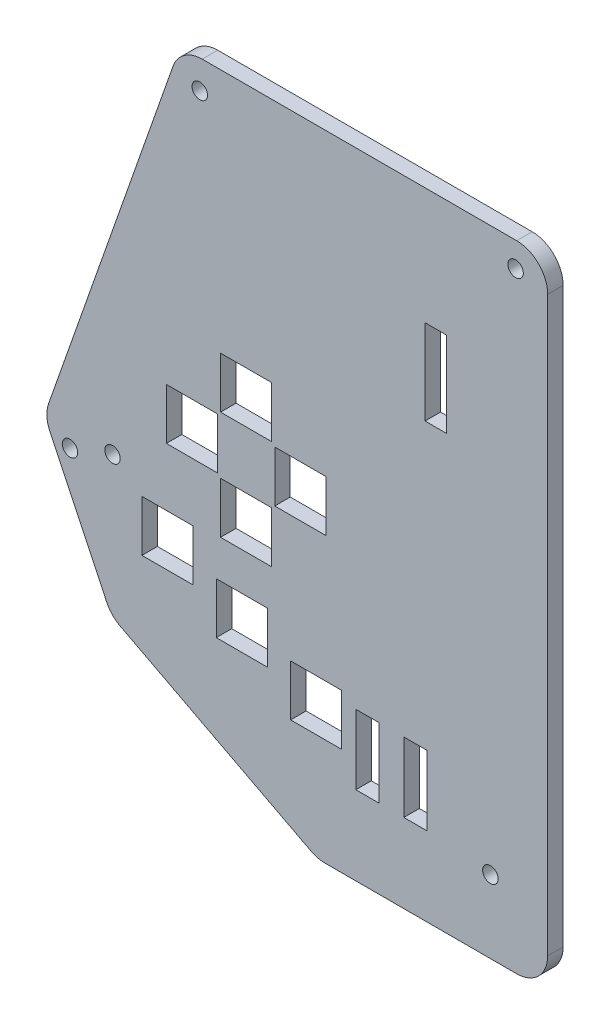
from build123d import *

# Parameters (mm, degrees)
BOSS_EXTRUDE1_DEPTH     = 2.54
CUT_EXTRUDE1_DEPTH      = 112.420336115
CUT_EXTRUDE1_DEPTH_BACK = 112.420336115
SKETCH11_W              = 3.81
SKETCH11_H              = 11.43
SKETCH11_W_2            = 8.382
SKETCH11_H_2            = 8.382
CUT_EXTRUDE2_DEPTH      = 112.420336115
CUT_EXTRUDE2_DEPTH_BACK = 112.420336115
SKETCH12_R              = 1.27
CUT_EXTRUDE3_DEPTH      = 112.420336115
CUT_EXTRUDE3_DEPTH_BACK = 112.420336115
SKETCH13_R              = 1.27
CUT_EXTRUDE4_DEPTH      = 112.420336115
CUT_EXTRUDE4_DEPTH_BACK = 112.420336115
SKETCH14_W              = 3.556
SKETCH14_H              = 13.97


with BuildPart() as part:
    # Sketch10 → Boss-Extrude1 (new body)
    with BuildSketch(Plane.XY):
        with BuildLine():
            Line((53.34, 1.27), (53.34, -92.71))
            ThreePointArc((53.34, -92.71), (51.852102448, -96.302102448), (48.26, -97.79))
            Line((48.26, -97.79), (16.846989059, -97.79))
            ThreePointArc((16.846989059, -97.79), (15.638688158, -97.644208035), (14.499741809, -97.215200367))
            Line((14.499741809, -97.215200367), (-16.7505185, -80.933552139))
            ThreePointArc((-16.7505185, -80.933552139), (-18.059258376, -79.955412607), (-18.989802686, -78.61241436))
            Line((-18.989802686, -78.61241436), (-28.309569459, -59.040904135))
            ThreePointArc((-28.309569459, -59.040904135), (-28.795802898, -57.127870198), (-28.51617555, -55.173917704))
            Line((-28.51617555, -55.173917704), (-8.107195629, 2.952923842))
            ThreePointArc((-8.107195629, 2.952923842), (-6.251501454, 5.414614163), (-3.314058103, 6.35))
            Line((-3.314058103, 6.35), (48.26, 6.35))
            ThreePointArc((48.26, 6.35), (51.852102448, 4.862102448), (53.34, 1.27))
        make_face()
    extrude(amount=BOSS_EXTRUDE1_DEPTH)

    # Sketch11 → Cut-Extrude1 (cut, two sides: drawn at the far end of the back side and taken through both)
    with BuildSketch(Plane.XY.offset(2.54).offset(-CUT_EXTRUDE1_DEPTH_BACK)):
        with Locations((31.65602, -79.121)):
            Rectangle(SKETCH11_W, SKETCH11_H)
        with Locations((23.78202, -79.121)):
            Rectangle(SKETCH11_W, SKETCH11_H)
        with Locations((3.878385852, -55.88)):
            Rectangle(SKETCH11_W_2, SKETCH11_H_2)
        with Locations((-5.011614148, -46.99)):
            Rectangle(SKETCH11_W_2, SKETCH11_H_2)
        with Locations((3.878385852, -38.1)):
            Rectangle(SKETCH11_W_2, SKETCH11_H_2)
        with Locations((12.768385852, -46.99)):
            Rectangle(SKETCH11_W_2, SKETCH11_H_2)
        with Locations((-9.017, -64.897)):
            Rectangle(SKETCH11_W_2, SKETCH11_H_2)
        with Locations((3.175, -70.485)):
            Rectangle(SKETCH11_W_2, SKETCH11_H_2)
        with Locations((15.367, -76.073)):
            Rectangle(SKETCH11_W_2, SKETCH11_H_2)
    extrude(amount=CUT_EXTRUDE1_DEPTH + CUT_EXTRUDE1_DEPTH_BACK, mode=Mode.SUBTRACT)

    # Sketch12 → Cut-Extrude2 (cut, two sides: drawn at the far end of the back side and taken through both)
    with BuildSketch(Plane(origin=(0, 0, 0), x_dir=(-1, 0, 0), z_dir=(0, 0, -1)).offset(-CUT_EXTRUDE2_DEPTH_BACK)):
        with Locations((18.034, -57.15)):
            Circle(SKETCH12_R)
        with Locations((-43.942, -85.852)):
            Circle(SKETCH12_R)
    extrude(amount=CUT_EXTRUDE2_DEPTH + CUT_EXTRUDE2_DEPTH_BACK, mode=Mode.SUBTRACT)

    # Sketch13 → Cut-Extrude3 (cut, two sides: drawn at the far end of the back side and taken through both)
    with BuildSketch(Plane(origin=(0, 0, 0), x_dir=(-1, 0, 0), z_dir=(0, 0, -1)).offset(-CUT_EXTRUDE3_DEPTH_BACK)):
        with Locations((25.012261453, -59.761967182)):
            Circle(SKETCH13_R)
        with Locations((-48.0822, 2.286)):
            Circle(SKETCH13_R)
        with Locations((3.718687848, 1.651)):
            Circle(SKETCH13_R)
    extrude(amount=CUT_EXTRUDE3_DEPTH + CUT_EXTRUDE3_DEPTH_BACK, mode=Mode.SUBTRACT)

    # Sketch14 → Cut-Extrude4 (cut, two sides: drawn at the far end of the back side and taken through both)
    with BuildSketch(Plane(origin=(0, 0, 0), x_dir=(-1, 0, 0), z_dir=(0, 0, -1)).offset(-CUT_EXTRUDE4_DEPTH_BACK)):
        with Locations((-35.010498686, -19.798068862)):
            Rectangle(SKETCH14_W, SKETCH14_H)
    extrude(amount=CUT_EXTRUDE4_DEPTH + CUT_EXTRUDE4_DEPTH_BACK, mode=Mode.SUBTRACT)


solid = part.part
